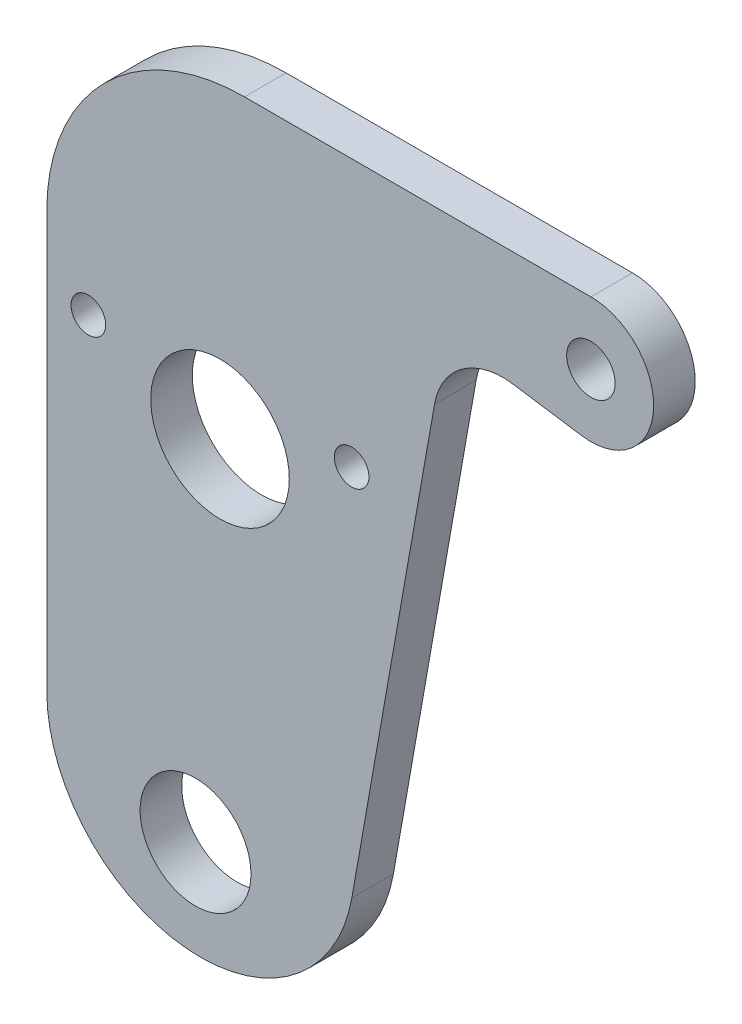
from build123d import *

# Parameters (mm, degrees)
SKETCH3_R           = 4
BOSS_EXTRUDE4_DEPTH = 3
SKETCH5_R           = 1.25
SKETCH5_R_2         = 5
CUT_EXTRUDE2_DEPTH  = 43.952434096
SKETCH6_R           = 1.75
CUT_EXTRUDE3_DEPTH  = 43.952434096


with BuildPart() as part:
    # Sketch3 → Boss-Extrude4 (new body)
    with BuildSketch(Plane.XY):
        with BuildLine():
            Line((-12.5, -15), (-12.5, 15))
            ThreePointArc((-12.5, 15), (-8.321357206, 25.088136105), (1.766778898, 29.266778898))
            Line((1.766778898, 29.266778898), (26.766778898, 29.266778898))
            ThreePointArc((26.766778898, 29.266778898), (31.28229963, 24.401899264), (26.095015576, 20.260756249))
            Line((26.095015576, 20.260756249), (21.150345096, 21.00253374))
            ThreePointArc((21.150345096, 21.00253374), (17.488439715, 20.116539535), (15.48452884, 16.926104149))
            Line((15.48452884, 16.926104149), (9.51547116, -16.926104149))
            ThreePointArc((9.51547116, -16.926104149), (-2.374739058, -26.049783342), (-12.5, -15))
        make_face()
        with Locations((-1.764648859, -19.076420455)):
            Circle(SKETCH3_R, mode=Mode.SUBTRACT)
    extrude(amount=BOSS_EXTRUDE4_DEPTH)

    # Sketch5 → Cut-Extrude2 (cut, through all)
    with BuildSketch(Plane.XY.offset(3)):
        with Locations((-9.5, 10)):
            Circle(SKETCH5_R)
        with Locations((9.5, 10)):
            Circle(SKETCH5_R)
        with Locations((0, 7)):
            Circle(SKETCH5_R_2)
    extrude(amount=-CUT_EXTRUDE2_DEPTH, mode=Mode.SUBTRACT)

    # Sketch6 → Cut-Extrude3 (cut, through all)
    with BuildSketch(Plane.XY.offset(3)):
        with Locations((26.766778898, 24.738714008)):
            Circle(SKETCH6_R)
    extrude(amount=-CUT_EXTRUDE3_DEPTH, mode=Mode.SUBTRACT)


solid = part.part
